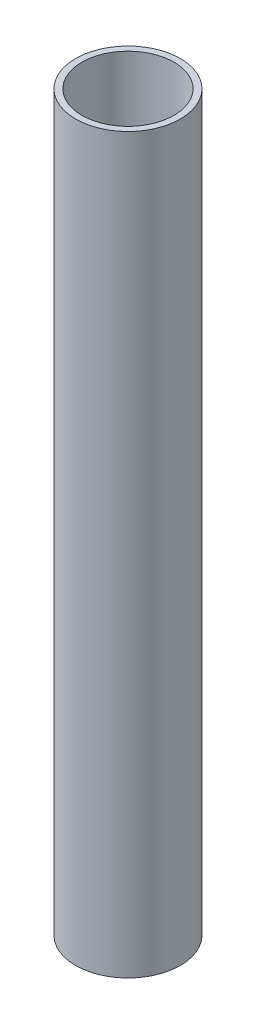
from build123d import *

# Parameters (mm, degrees)
SKETCH_1_R      = 12.5
SKETCH_1_R_2    = 11
EXTRUDE_1_DEPTH = 175


with BuildPart() as part:
    # 草图1 → 凸台-拉伸1 (new body)
    with BuildSketch(Plane(origin=(0, 0, 0), x_dir=(1, 0, 0), z_dir=(0, 1, 0))):
        with Locations(Location((0, 0, 0), (0, 0, 270))):
            Circle(SKETCH_1_R)
        with Locations(Location((0, 0, 0), (0, 0, 270))):
            Circle(SKETCH_1_R_2, mode=Mode.SUBTRACT)
    extrude(amount=EXTRUDE_1_DEPTH)


solid = part.part
